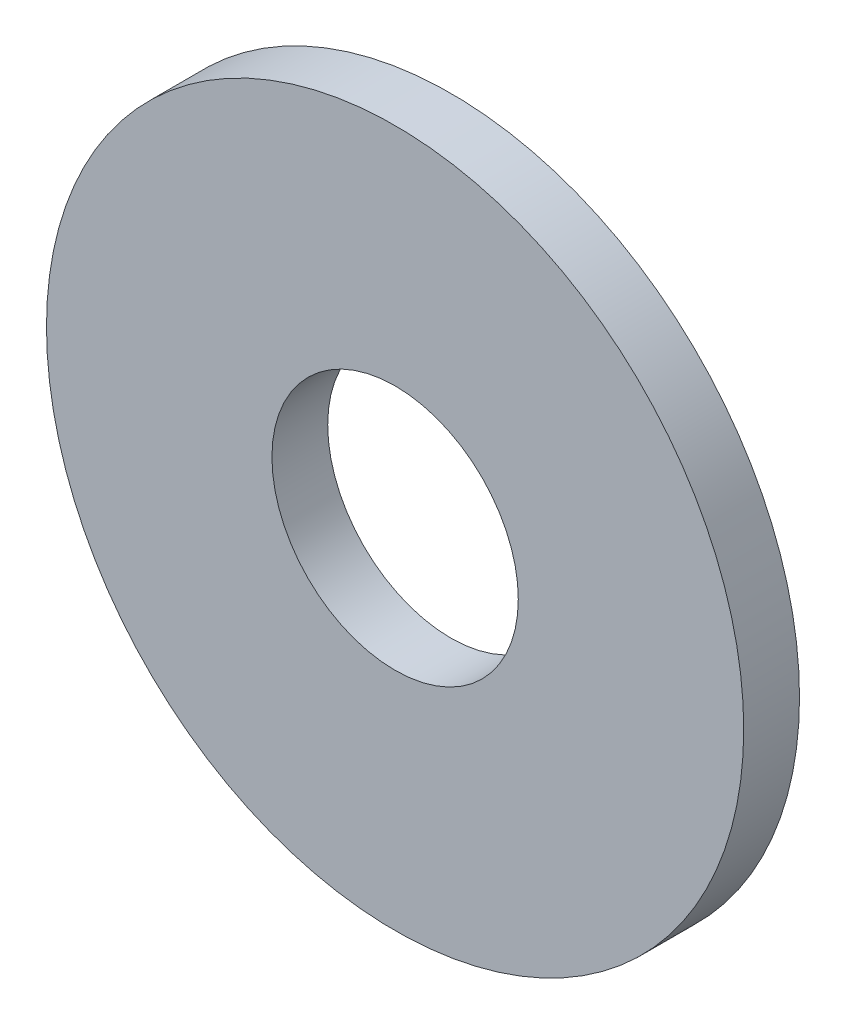
from build123d import *

# Parameters (mm, degrees)
SKETCH1_R           = 7.5
SKETCH1_R_2         = 2.65
BOSS_EXTRUDE1_DEPTH = 1.2


with BuildPart() as part:
    # Sketch1 → Boss-Extrude1 (new body)
    with BuildSketch(Plane.XY):
        Circle(SKETCH1_R)
        Circle(SKETCH1_R_2, mode=Mode.SUBTRACT)
    extrude(amount=BOSS_EXTRUDE1_DEPTH)


solid = part.part
